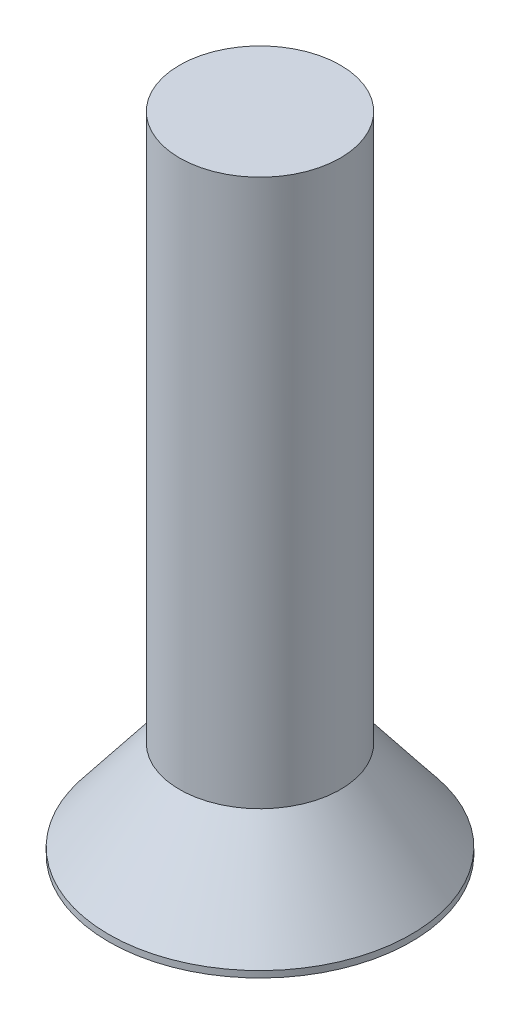
from build123d import *

# Parameters (mm, degrees)
SKETCH1_R           = 1.25
BOSS_EXTRUDE1_DEPTH = 10
CUT_EXTRUDE1_DEPTH  = 0.5


with BuildPart() as part:
    # Sketch1 → Boss-Extrude1 (new body)
    with BuildSketch(Plane(origin=(0, 0, 0), x_dir=(1, 0, 0), z_dir=(0, 1, 0))):
        with Locations(Location((0, 0, 0), (0, 0, 270))):
            Circle(SKETCH1_R)
    extrude(amount=BOSS_EXTRUDE1_DEPTH)

    # Sketch2 → Revolve1 (revolve)
    with BuildSketch(Plane(origin=(0, 0, 0), x_dir=(0, 0, -1), z_dir=(1, 0, 0)), mode=Mode.PRIVATE) as revolve1_sk:
        Polygon((0, 0), (0, 1.5), (-1.25, 1.5), (-2.35, 0.1), (-2.35, 0), align=None)
    revolve(revolve1_sk.sketch.rotate(Axis((0, -0.5, 0), (0, 1, 0)), 180), axis=Axis((0, -0.5, 0), (0, 1, 0)))

    # Sketch3 → Cut-Extrude1 (cut)
    with BuildSketch(Plane.XZ):
        Polygon((-1.5, -0.25), (-0.25, -0.25), (-0.25, -1.5), (0.25, -1.5), (0.25, -0.25), (1.5, -0.25), (1.5, 0.25), (0.25, 0.25), (0.25, 1.5), (-0.25, 1.5), (-0.25, 0.25), (-1.5, 0.25), align=None)
    extrude(amount=-CUT_EXTRUDE1_DEPTH, mode=Mode.SUBTRACT)


solid = part.part
